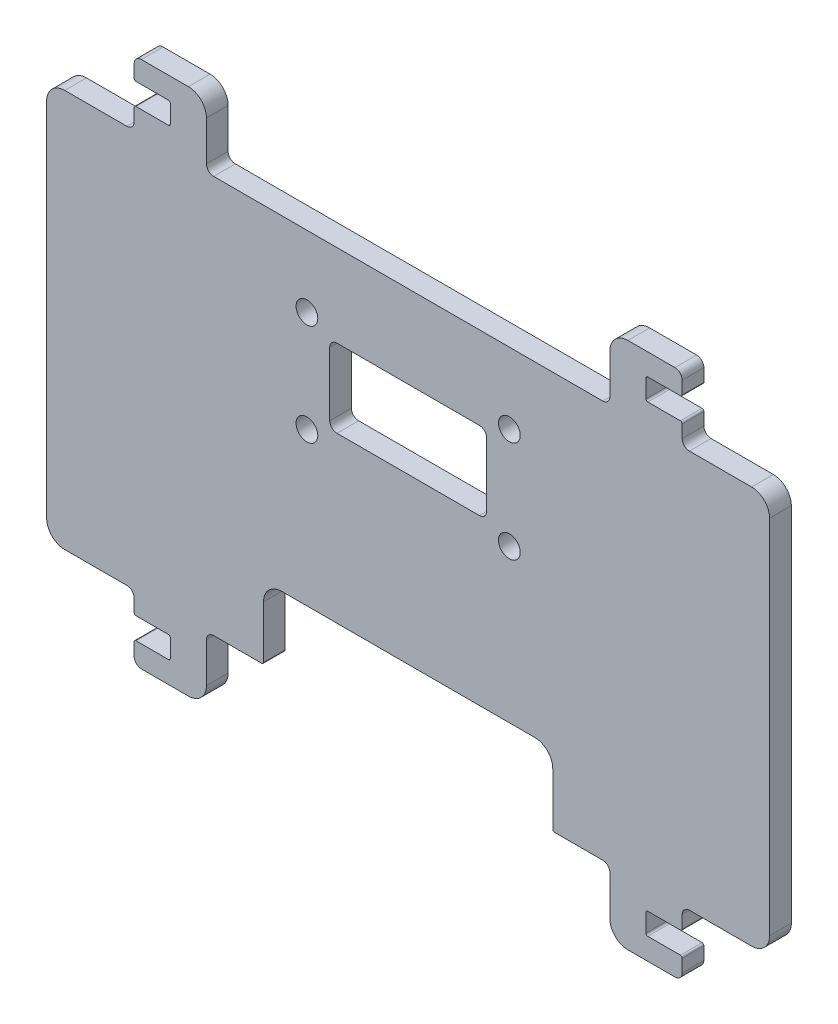
from build123d import *

# Parameters (mm, degrees)
CROQUIS1_R              = 1.5
CROQUIS1_W              = 21.7
CROQUIS1_H              = 10.8
SALIENTE_EXTRUIR1_DEPTH = 3
CORTAR_EXTRUIR2_DEPTH   = 3
REDONDEO1_R             = 1
REDONDEO2_R             = 0.25


with BuildPart() as part:
    # Croquis1 → Saliente-Extruir1 (new body)
    with BuildSketch(Plane.XY):
        with BuildLine():
            Line((-50, 25), (-50, -25))
            ThreePointArc((-50, -25), (-49.267766953, -26.767766953), (-47.5, -27.5))
            Line((-47.5, -27.5), (-37.9, -27.5))
            Line((-37.9, -27.5), (-37.9, -30.5))
            Line((-37.9, -30.5), (-32.9, -30.5))
            Line((-32.9, -30.5), (-32.9, -33.5))
            Line((-32.9, -33.5), (-37.9, -33.5))
            Line((-37.9, -33.5), (-37.9, -36.5))
            Line((-37.9, -36.5), (-30.4, -36.5))
            ThreePointArc((-30.4, -36.5), (-28.632233047, -35.767766953), (-27.9, -34))
            Line((-27.9, -34), (-27.9, -27.5))
            Line((-27.9, -27.5), (27.9, -27.5))
            Line((27.9, -27.5), (27.9, -34))
            ThreePointArc((27.9, -34), (28.632233047, -35.767766953), (30.4, -36.5))
            Line((30.4, -36.5), (37.9, -36.5))
            Line((37.9, -36.5), (37.9, -33.5))
            Line((37.9, -33.5), (32.9, -33.5))
            Line((32.9, -33.5), (32.9, -30.5))
            Line((32.9, -30.5), (37.9, -30.5))
            Line((37.9, -30.5), (37.9, -27.5))
            Line((37.9, -27.5), (47.5, -27.5))
            ThreePointArc((47.5, -27.5), (49.267766953, -26.767766953), (50, -25))
            Line((50, -25), (50, 25))
            ThreePointArc((50, 25), (49.267766953, 26.767766953), (47.5, 27.5))
            Line((47.5, 27.5), (37.9, 27.5))
            Line((37.9, 27.5), (37.9, 30.5))
            Line((37.9, 30.5), (32.9, 30.5))
            Line((32.9, 30.5), (32.9, 33.5))
            Line((32.9, 33.5), (37.9, 33.5))
            Line((37.9, 33.5), (37.9, 36.5))
            Line((37.9, 36.5), (30.4, 36.5))
            ThreePointArc((30.4, 36.5), (28.632233047, 35.767766953), (27.9, 34))
            Line((27.9, 34), (27.9, 27.5))
            Line((27.9, 27.5), (-27.9, 27.5))
            Line((-27.9, 27.5), (-27.9, 34))
            ThreePointArc((-27.9, 34), (-28.632233047, 35.767766953), (-30.4, 36.5))
            Line((-30.4, 36.5), (-37.9, 36.5))
            Line((-37.9, 36.5), (-37.9, 33.5))
            Line((-37.9, 33.5), (-32.9, 33.5))
            Line((-32.9, 33.5), (-32.9, 30.5))
            Line((-32.9, 30.5), (-37.9, 30.5))
            Line((-37.9, 30.5), (-37.9, 27.5))
            Line((-37.9, 27.5), (-47.5, 27.5))
            ThreePointArc((-47.5, 27.5), (-49.267766953, 26.767766953), (-50, 25))
        make_face()
        with Locations((-14, 17.663397979)):
            Circle(CROQUIS1_R, mode=Mode.SUBTRACT)
        with Locations(Location((14, 17.663397979, 0), (0, 0, 180))):
            Circle(CROQUIS1_R, mode=Mode.SUBTRACT)
        with Locations((14, 3.643397979)):
            Circle(CROQUIS1_R, mode=Mode.SUBTRACT)
        with Locations(Location((-14, 3.643397979, 0), (0, 0, 180))):
            Circle(CROQUIS1_R, mode=Mode.SUBTRACT)
        with Locations((0, 10.653397979)):
            Rectangle(CROQUIS1_W, CROQUIS1_H, mode=Mode.SUBTRACT)
    extrude(amount=SALIENTE_EXTRUIR1_DEPTH)

    # Croquis2 → Cortar-Extruir2 (cut, symmetric)
    with BuildSketch(Plane.XY):
        with BuildLine():
            Line((-17.5, -17.5), (17.5, -17.5))
            ThreePointArc((17.5, -17.5), (19.267766953, -18.232233047), (20, -20))
            Line((20, -20), (20, -37.5))
            Line((20, -37.5), (-20, -37.5))
            Line((-20, -37.5), (-20, -20))
            ThreePointArc((-20, -20), (-19.267766953, -18.232233047), (-17.5, -17.5))
        make_face()
    extrude(amount=CORTAR_EXTRUIR2_DEPTH, both=True, mode=Mode.SUBTRACT)

    # Redondeo1
    redondeo1_edges = [part.edges().sort_by_distance(p)[0] for p in [
        (10.85, 5.253397979, 1.5),
        (10.85, 16.053397979, 1.5),
        (-10.85, 16.053397979, 1.5),
        (-10.85, 5.253397979, 1.5),
        (-37.9, -27.5, 1.5),
        (-37.9, 27.5, 1.5),
        (-37.9, 36.5, 1.5),
        (-27.9, 27.5, 1.5),
        (27.9, 27.5, 1.5),
        (37.9, 36.5, 1.5),
        (37.9, 27.5, 1.5),
        (37.9, -27.5, 1.5),
        (37.9, -36.5, 1.5),
        (27.9, -27.5, 1.5),
        (-27.9, -27.5, 1.5),
        (-37.9, -36.5, 1.5),
    ]]
    fillet(redondeo1_edges, radius=REDONDEO1_R)

    # Redondeo2
    redondeo2_edges = [part.edges().sort_by_distance(p)[0] for p in [
        (20, -27.5, 1.5),
        (-20, -27.5, 1.5),
        (-37.9, 30.5, 1.5),
        (-32.9, 30.5, 1.5),
        (-32.9, 33.5, 1.5),
        (-37.9, 33.5, 1.5),
        (37.9, 33.5, 1.5),
        (32.9, 33.5, 1.5),
        (32.9, 30.5, 1.5),
        (37.9, 30.5, 1.5),
        (37.9, -30.5, 1.5),
        (32.9, -30.5, 1.5),
        (32.9, -33.5, 1.5),
        (37.9, -33.5, 1.5),
        (-37.9, -33.5, 1.5),
        (-32.9, -33.5, 1.5),
        (-32.9, -30.5, 1.5),
        (-37.9, -30.5, 1.5),
    ]]
    fillet(redondeo2_edges, radius=REDONDEO2_R)


solid = part.part
